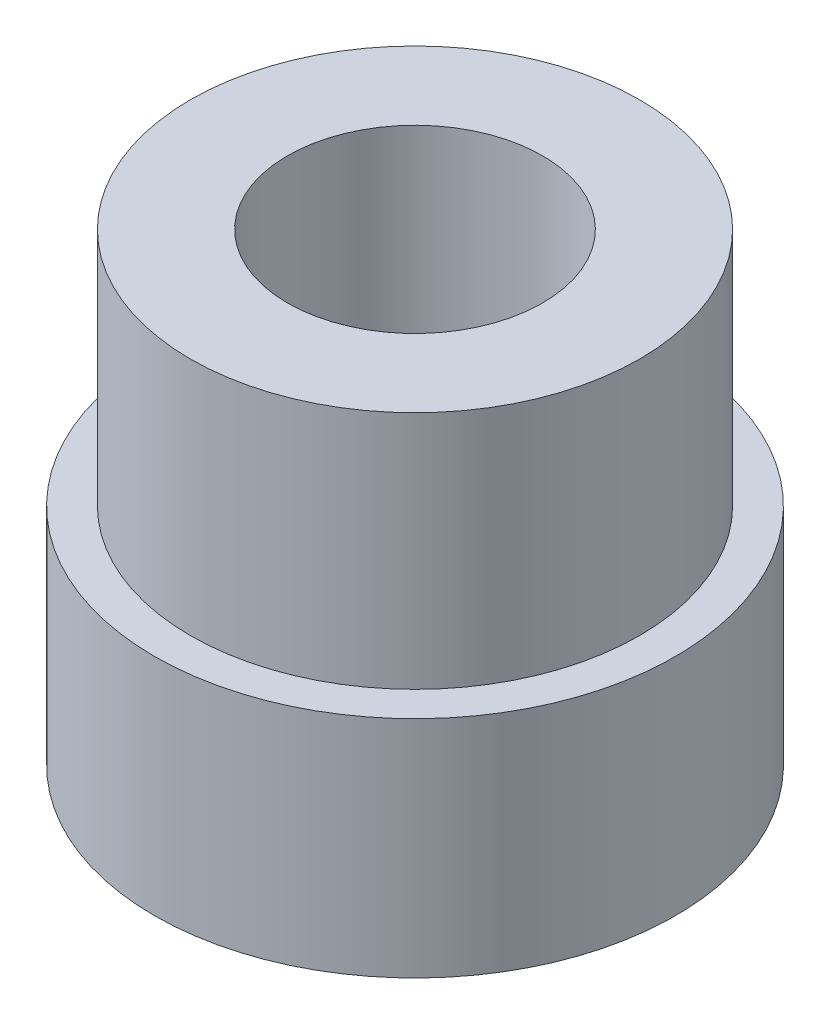
from build123d import *

# Parameters (mm, degrees)
SKETCH1_R           = 5.5245
BOSS_EXTRUDE1_DEPTH = 4.7625
SKETCH2_R           = 4.7625
BOSS_EXTRUDE2_DEPTH = 5.08
SKETCH3_R           = 2.7051
CUT_EXTRUDE1_DEPTH  = 13.566423785


with BuildPart() as part:
    # Sketch1 → Boss-Extrude1 (new body)
    with BuildSketch(Plane(origin=(0, 0, 0), x_dir=(1, 0, 0), z_dir=(0, 1, 0))):
        with Locations(Location((0, 0, 0), (0, 0, 90))):
            Circle(SKETCH1_R)
    extrude(amount=BOSS_EXTRUDE1_DEPTH)

    # Sketch2 → Boss-Extrude2 (add)
    with BuildSketch(Plane(origin=(0, 4.7625, 0), x_dir=(1, 0, 0), z_dir=(0, 1, 0))):
        with Locations(Location((0, 0, 0), (0, 0, 270))):
            Circle(SKETCH2_R)
    extrude(amount=BOSS_EXTRUDE2_DEPTH)

    # Sketch3 → Cut-Extrude1 (cut, through all)
    with BuildSketch(Plane(origin=(0, 9.8425, 0), x_dir=(1, 0, 0), z_dir=(0, 1, 0))):
        with Locations(Location((0, 0, 0), (0, 0, 270))):
            Circle(SKETCH3_R)
    extrude(amount=-CUT_EXTRUDE1_DEPTH, mode=Mode.SUBTRACT)


solid = part.part
